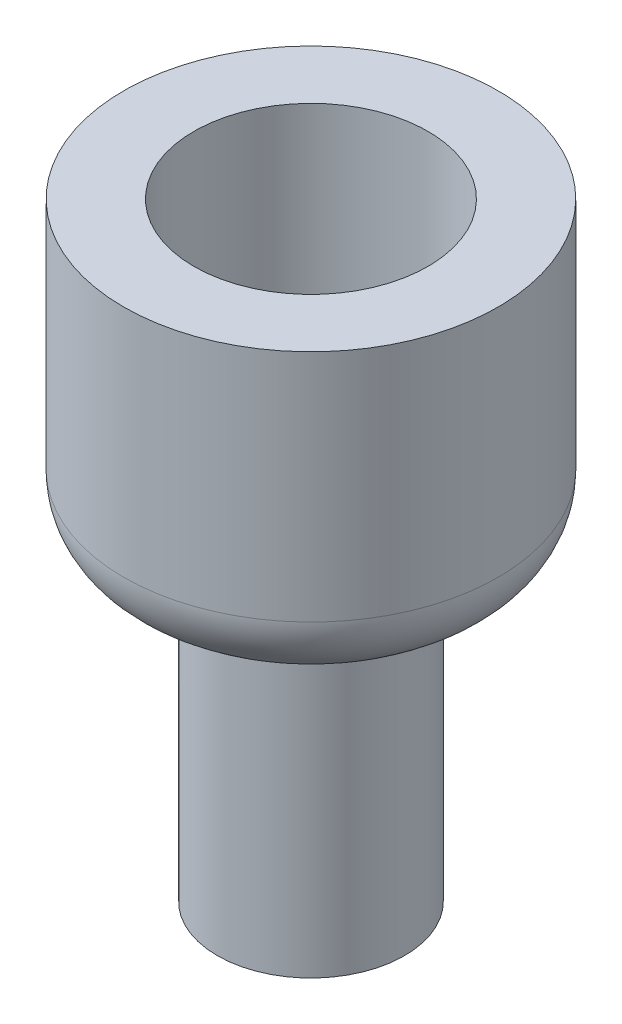
from build123d import *


with BuildPart() as part:
    # Sketch1 → Revolve1 (revolve)
    with BuildSketch(Plane.XY, mode=Mode.PRIVATE) as revolve1_sk:
        with BuildLine():
            Line((-2.5, 0), (-2, 0))
            Line((-2, 0), (-2, -6.5))
            Line((-2, -6.5), (-0.75, -6.5))
            Line((-0.75, -6.5), (-0.75, 1.5))
            Line((-0.75, 1.5), (-2.5, 2.510362971))
            Line((-2.5, 2.510362971), (-2.5, 6.5))
            Line((-2.5, 6.5), (-4, 6.5))
            Line((-4, 6.5), (-4, 1.5))
            ThreePointArc((-4, 1.5), (-3.560660172, 0.439339828), (-2.5, 0))
        make_face()
    revolve(revolve1_sk.sketch.rotate(Axis((0, 0, 0), (0, -1, 0)), 270), axis=Axis((0, 0, 0), (0, -1, 0)))


solid = part.part
